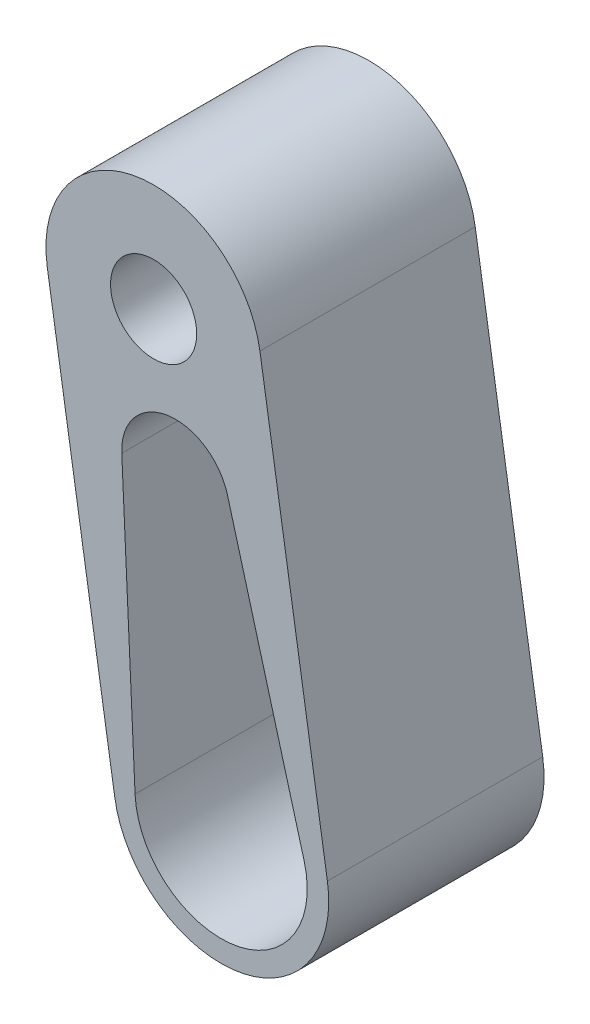
from build123d import *

# Parameters (mm, degrees)
SKETCH1_R           = 2
BOSS_EXTRUDE1_DEPTH = 10
CUT_EXTRUDE1_START  = -8
CUT_EXTRUDE1_DEPTH  = 8


with BuildPart() as part:
    # Sketch1 → Boss-Extrude1 (new body)
    with BuildSketch(Plane.XY):
        with BuildLine():
            Line((-64.072556879, 14.969286371), (-60.938217786, -4.783584773))
            ThreePointArc((-60.938217786, -4.783584773), (-55.216415227, -8.938217786), (-51.061782214, -3.216415227))
            Line((-51.061782214, -3.216415227), (-54.196121307, 16.536455918))
            ThreePointArc((-54.196121307, 16.536455918), (-59.917923866, 20.691088931), (-64.072556879, 14.969286371))
        make_face()
        with Locations((-59.134339093, 15.752871145)):
            Circle(SKETCH1_R, mode=Mode.SUBTRACT)
        with Locations((-56, -4)):
            Circle(SKETCH1_R, mode=Mode.SUBTRACT)
    extrude(amount=BOSS_EXTRUDE1_DEPTH)

    # Sketch2 → Cut-Extrude1 (cut)
    with BuildSketch(Plane.XY.offset(10).offset(CUT_EXTRUDE1_START)):
        with BuildLine():
            ThreePointArc((-55.686566091, -5.975287114), (-57.975287114, -4.313433909), (-56.313433909, -2.024712886))
            Line((-56.313433909, -2.024712886), (-57.567169546, 5.876435572))
            Line((-57.567169546, 5.876435572), (-58.507471274, 11.802296916))
            ThreePointArc((-58.507471274, 11.802296916), (-60.053776286, 10.912358208), (-60.613031521, 9.218167051))
            Line((-60.613031521, 9.218167051), (-59.995764214, -4.184033555))
            ThreePointArc((-59.995764214, -4.184033555), (-58.526672296, -7.100955838), (-55.373132181, -7.950574229))
            Line((-55.373132181, -7.950574229), (-55.686566091, -5.975287114))
        make_face()
        with BuildLine():
            Line((-57.567169546, 5.876435572), (-56.313433909, -2.024712886))
            ThreePointArc((-56.313433909, -2.024712886), (-54.701321406, -2.479002331), (-54, -4))
            ThreePointArc((-54, -4), (-54.479002331, -5.298678594), (-55.686566091, -5.975287114))
            Line((-55.686566091, -5.975287114), (-55.373132181, -7.950574229))
            ThreePointArc((-55.373132181, -7.950574229), (-52.637503946, -6.166476468), (-52.143539746, -2.938061061))
            Line((-52.143539746, -2.938061061), (-55.705391229, 9.996899859))
            ThreePointArc((-55.705391229, 9.996899859), (-56.761631095, 11.434748057), (-58.507471274, 11.802296916))
            Line((-58.507471274, 11.802296916), (-57.567169546, 5.876435572))
        make_face()
    extrude(amount=CUT_EXTRUDE1_DEPTH, mode=Mode.SUBTRACT)


solid = part.part
